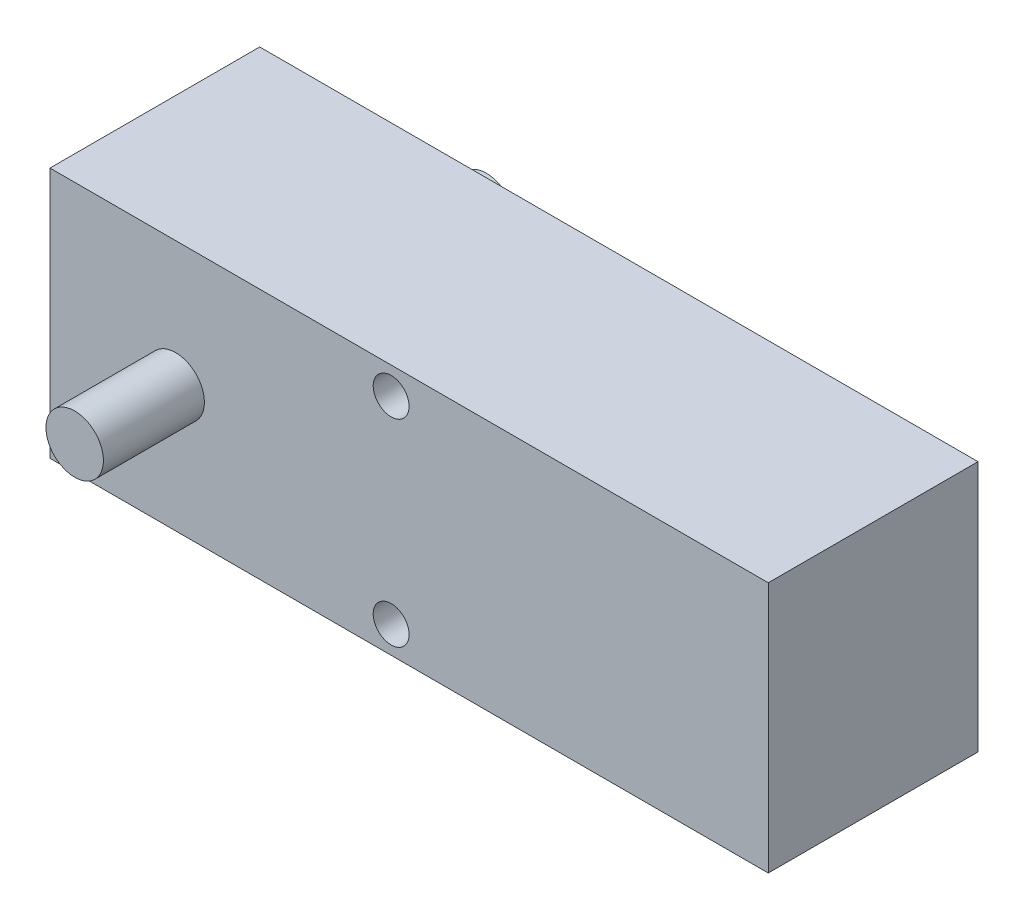
from build123d import *

# Parameters (mm, degrees)
SKETCH1_R               = 2.54
BOSS_EXTRUDE1_DEPTH     = 18.1991
SKETCH2_W               = 63.5
SKETCH2_H               = 22.225
BOSS_EXTRUDE2_DEPTH     = 9.271
CUT_EXTRUDE1_DEPTH      = 61.187575184
CUT_EXTRUDE1_DEPTH_BACK = 61.187575184
SKETCH3_R               = 1.5875


with BuildPart() as part:
    # Sketch1 → Boss-Extrude1 (new, symmetric)
    with BuildSketch(Plane.XY):
        Circle(SKETCH1_R)
    extrude(amount=BOSS_EXTRUDE1_DEPTH, both=True)

    # Sketch2 → Boss-Extrude2 (add, symmetric)
    with BuildSketch(Plane.XY):
        with Locations((20.6375, 0)):
            Rectangle(SKETCH2_W, SKETCH2_H)
    extrude(amount=BOSS_EXTRUDE2_DEPTH, both=True)

    # Sketch3 → Cut-Extrude1 (cut, two sides: drawn at the far end of the back side and taken through both)
    with BuildSketch(Plane.XY.offset(9.271).offset(-CUT_EXTRUDE1_DEPTH_BACK)):
        with Locations((19.05, -8.73125)):
            Circle(SKETCH3_R)
        with Locations((19.05, 8.73125)):
            Circle(SKETCH3_R)
    extrude(amount=CUT_EXTRUDE1_DEPTH + CUT_EXTRUDE1_DEPTH_BACK, mode=Mode.SUBTRACT)


solid = part.part
